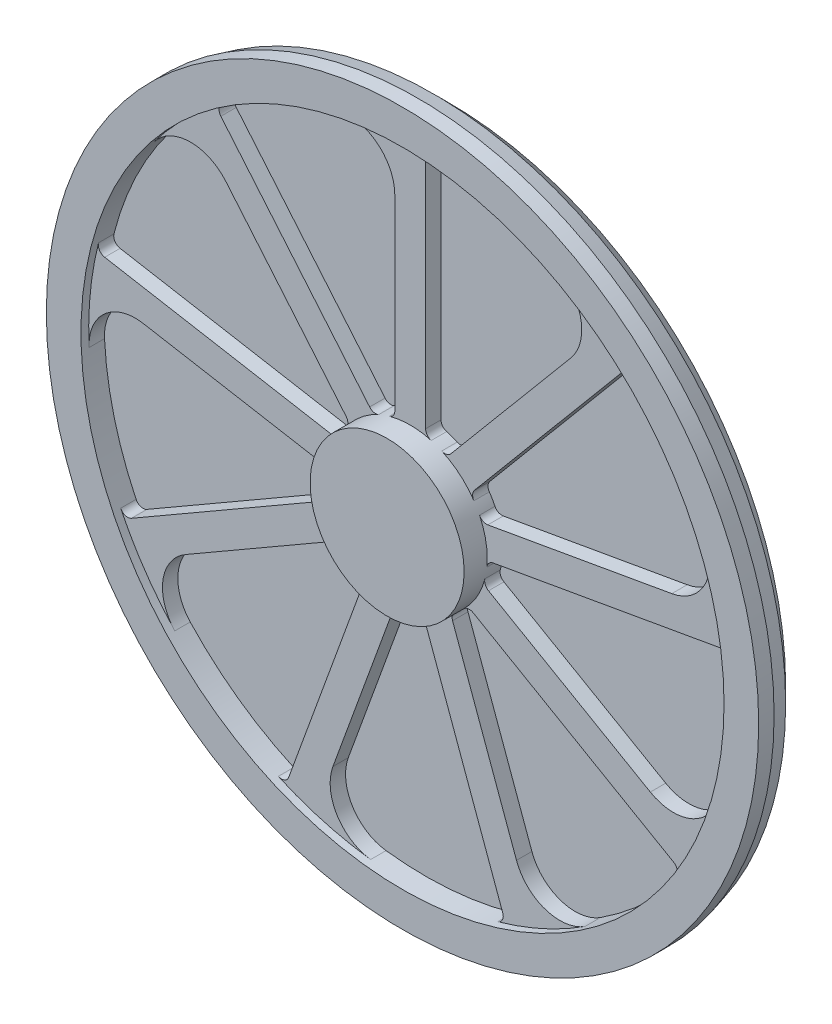
from build123d import *

# Parameters (mm, degrees)
BOSS_EXTRUDE1_DEPTH      = 20
FILLET1_R                = 60
FILLET2_R                = 10
CIRPATTERN1_COUNT        = 9
FILLET1_OF_CIRPATTERN1_R = 60
FILLET2_OF_CIRPATTERN1_R = 10


with BuildPart() as part:
    # Sketch1 → Revolve1 (revolve)
    with BuildSketch(Plane(origin=(0, 0, 0), x_dir=(0, 0, -1), z_dir=(1, 0, 0)), mode=Mode.PRIVATE) as revolve1_sk:
        Polygon((0, 0), (0, 100), (50, 100), (50, 417.5), (20, 417.5), (20, 462.5), (40, 462.5), (60.490381057, 457.009618943), (80, 437.5), (80, 0), align=None)
    revolve(revolve1_sk.sketch.rotate(Axis((0, 0, 404.979253112), (0, 0, -1)), 90), axis=Axis((0, 0, 404.979253112), (0, 0, -1)))

    # Sketch2 → Boss-Extrude1 (add)
    with BuildSketch(Plane.XY.offset(-50)):
        with BuildLine():
            Line((-20, 97.979589711), (-20, 417.02068294))
            ThreePointArc((-20, 417.02068294), (0, 417.5), (20, 417.02068294))
            Line((20, 417.02068294), (20, 97.979589711))
            ThreePointArc((20, 97.979589711), (0, 100), (-20, 97.979589711))
        make_face()
    boss_extrude1 = extrude(amount=BOSS_EXTRUDE1_DEPTH)

    # Fillet1
    fillet1_edges = [part.edges().sort_by_distance(p)[0] for p in [
        (-20, 417.02068294, -40),
    ]]
    fillet(fillet1_edges, radius=FILLET1_R)

    # Fillet2
    fillet2_edges = [part.edges().sort_by_distance(p)[0] for p in [
        (20, 417.02068294, -40),
        (20, 97.979589711, -40),
        (-20, 97.979589711, -40),
    ]]
    fillet(fillet2_edges, radius=FILLET2_R)

    # CirPattern1: Boss-Extrude1 ×9 about axis
    cirpattern1_axis = Axis((0, 0, 0), (0, 0, 1))
    for i in range(1, CIRPATTERN1_COUNT):
        add(boss_extrude1.rotate(cirpattern1_axis, i * 360 / CIRPATTERN1_COUNT))

    # Fillet1 of CirPattern1
    fillet1_of_cirpattern1_edges = [part.edges().sort_by_distance(p)[0] for p in [
        (-283.376616839, 306.600624638, -40),
        (-414.158165279, 52.718726582, -40),
        (-351.15050533, -225.830849546, -40),
        (-123.835621333, -398.711661341, -40),
        (161.423326165, -385.030855608, -40),
        (371.15050533, -191.189833394, -40),
        (407.212238173, 92.111036702, -40),
        (252.734839115, 332.312129026, -40),
    ]]
    fillet(fillet1_of_cirpattern1_edges, radius=FILLET1_OF_CIRPATTERN1_R)

    # Fillet2 of CirPattern1
    fillet2_of_cirpattern1_edges = [part.edges().sort_by_distance(p)[0] for p in [
        (-252.734839115, 332.312129026, -40),
        (-47.659177406, 87.912472431, -40),
        (-78.300955131, 62.200968044, -40),
        (-407.212238173, 92.111036702, -40),
        (-93.018096031, 36.710132262, -40),
        (-99.964023138, -2.682177858, -40),
        (-371.15050533, -191.189833394, -40),
        (-94.852813742, -31.66928678, -40),
        (-74.852813742, -66.310302931, -40),
        (-161.423326165, -385.030855608, -40),
        (-52.304845732, -85.230294573, -40),
        (-14.7171409, -98.911100306, -40),
        (123.835621333, -398.711661341, -40),
        (14.7171409, -98.911100306, -40),
        (52.304845732, -85.230294573, -40),
        (351.15050533, -225.830849546, -40),
        (74.852813742, -66.310302931, -40),
        (94.852813742, -31.66928678, -40),
        (414.158165279, 52.718726582, -40),
        (99.964023138, -2.682177858, -40),
        (93.018096031, 36.710132262, -40),
        (283.376616839, 306.600624638, -40),
        (78.300955131, 62.200968044, -40),
        (47.659177406, 87.912472431, -40),
    ]]
    fillet(fillet2_of_cirpattern1_edges, radius=FILLET2_OF_CIRPATTERN1_R)


solid = part.part
